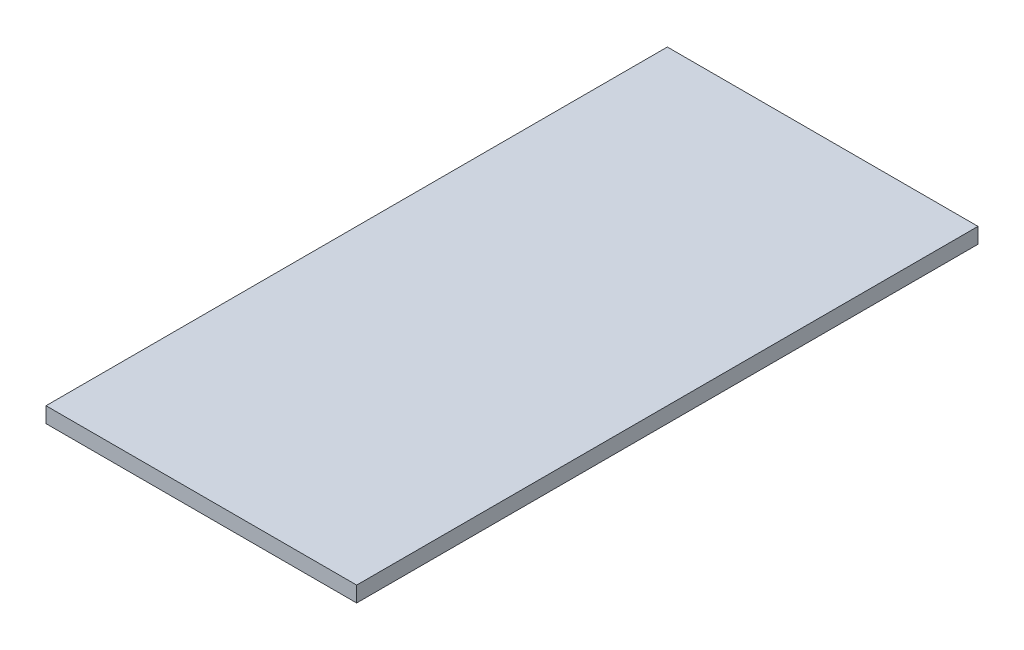
from build123d import *

# Parameters (mm, degrees)
SKETCH1_W           = 100
SKETCH1_H           = 200
BOSS_EXTRUDE2_DEPTH = 5


with BuildPart() as part:
    # Sketch1 → Boss-Extrude2 (new body)
    with BuildSketch(Plane(origin=(0, 0, 0), x_dir=(1, 0, 0), z_dir=(0, 1, 0))):
        Rectangle(SKETCH1_W, SKETCH1_H)
    extrude(amount=BOSS_EXTRUDE2_DEPTH)


solid = part.part
